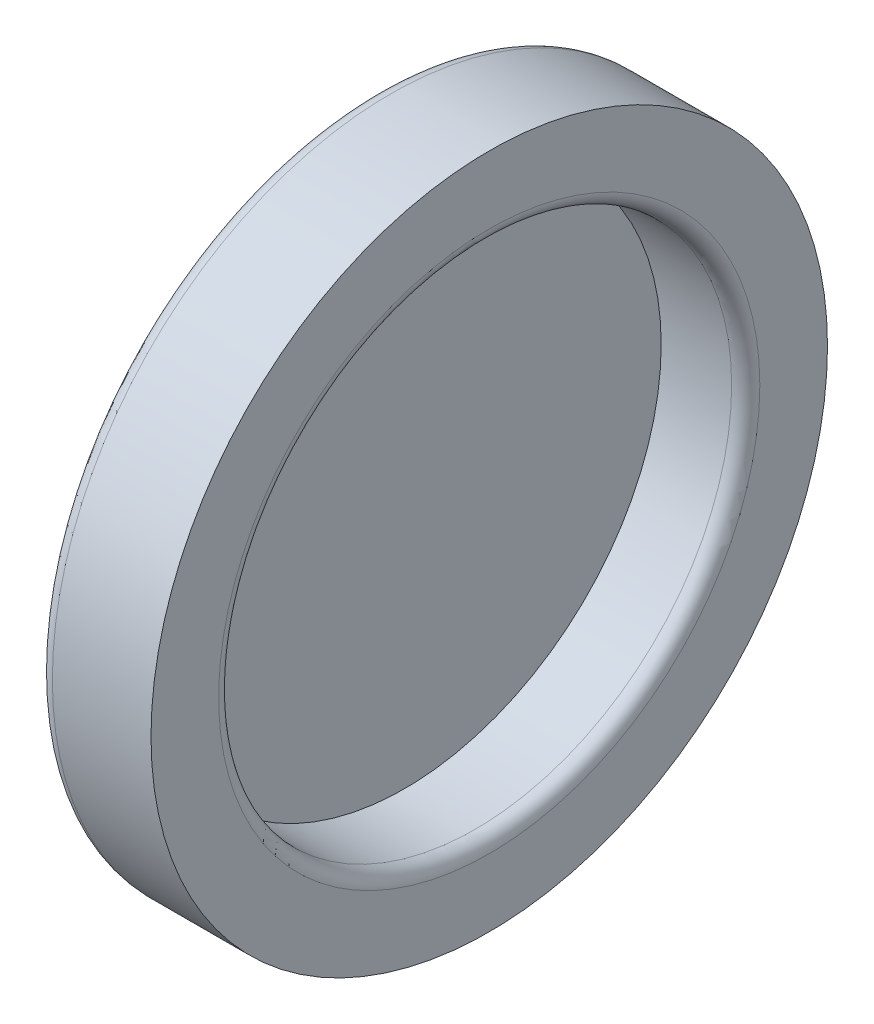
from build123d import *

# Parameters (mm, degrees)
SKETCH_1_R          = 12
EXTRUDE_1_DEPTH     = 4
SKETCH_2_R          = 9.1
CUT_EXTRUDE_1_DEPTH = 3
FILLET_1_R          = 0.5
FILLET_2_R          = 0.5


with BuildPart() as part:
    # 草图1 → 凸台-拉伸1 (new body)
    with BuildSketch(Plane(origin=(0, 0, 0), x_dir=(0, 0, -1), z_dir=(1, 0, 0))):
        Circle(SKETCH_1_R)
    extrude(amount=EXTRUDE_1_DEPTH)

    # 草图2 → 切除-拉伸1 (cut)
    with BuildSketch(Plane(origin=(4, 0, 0), x_dir=(0, 0, -1), z_dir=(1, 0, 0))):
        Circle(SKETCH_2_R)
    extrude(amount=-CUT_EXTRUDE_1_DEPTH, mode=Mode.SUBTRACT)

    # 圆角1
    fillet_1_edges = [part.edges().sort_by_distance(p)[0] for p in [
        (4, 0, 9.1),
    ]]
    fillet(fillet_1_edges, radius=FILLET_1_R)

    # 圆角2
    fillet_2_edges = [part.edges().sort_by_distance(p)[0] for p in [
        (0, 0, 12),
    ]]
    fillet(fillet_2_edges, radius=FILLET_2_R)


solid = part.part
